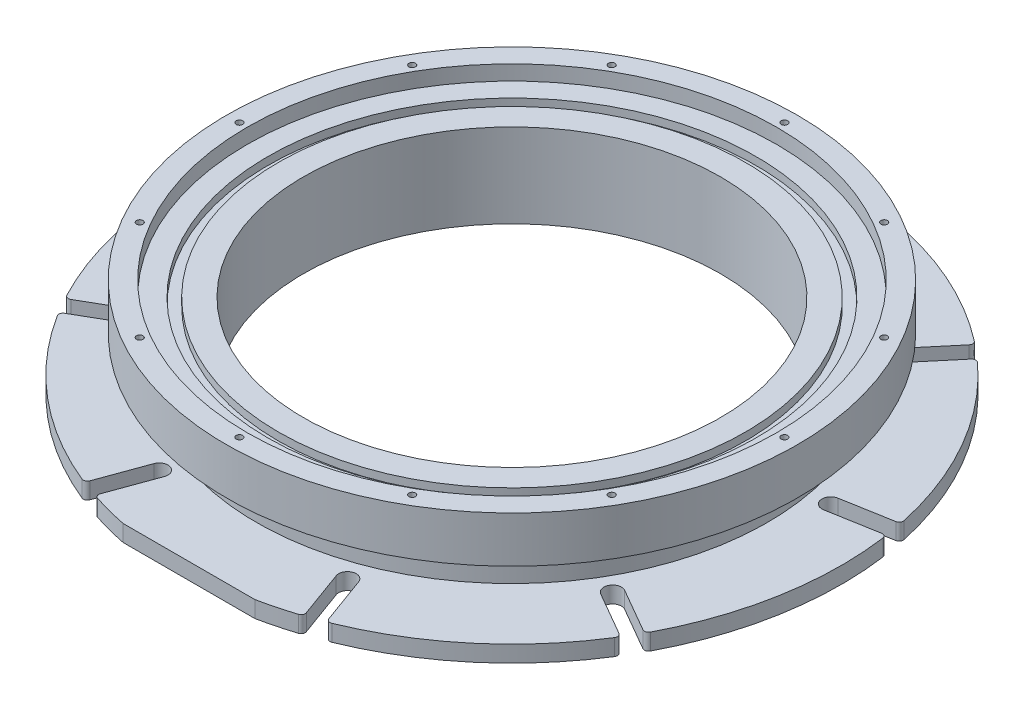
from build123d import *

# Parameters (mm, degrees)
M3X0_5_TAPPED_HOLE1_D     = 2.5
M3X0_5_TAPPED_HOLE1_DEPTH = 13.4874
M3X0_5_TAPPED_HOLE1_TIP   = 0.751075774
CUT_EXTRUDE1_REACH        = 185.602
SKETCH7_W                 = 50.8
SKETCH7_H                 = 2.565921067
CUT_EXTRUDE2_REACH        = 185.602
FILLET1_R                 = 1.5875
CIRPATTERN1_COUNT         = 9
FILLET1_OF_CIRPATTERN1_R  = 1.5875
SKETCH11_R                = 94
SKETCH11_R_2              = 90
CUT_EXTRUDE3_DEPTH        = 3


with BuildPart() as part:
    # Sketch1 → Revolve1 (revolve)
    with BuildSketch(Plane.XY, mode=Mode.PRIVATE) as revolve1_sk:
        Polygon((80.3783, 0), (127, 0), (127, 6.35), (98.425, 6.35), (98.425, 20.32), (110, 20.32), (110, 38.1), (102, 38.1), (102, 32.34), (80.3783, 32.34), align=None)
    revolve(revolve1_sk.sketch.rotate(Axis((0, 0, 0), (0, 1, 0)), 90), axis=Axis((0, 0, 0), (0, 1, 0)))

    # M3x0.5 Tapped Hole1
    with Locations(Plane(origin=(0, 38.1, 0), x_dir=(1, 0, 0), z_dir=(0, 1, 0))):
        with Locations((0, 105), (52.5, 90.932667397), (90.932667397, 52.5), (105, 0), (90.932667397, -52.5), (52.5, -90.932667397), (0, -105), (-52.5, -90.932667397), (-90.932667397, -52.5), (-105, 0), (-90.932667397, 52.5), (-52.5, 90.932667397)):
            Hole(M3X0_5_TAPPED_HOLE1_D / 2, depth=M3X0_5_TAPPED_HOLE1_DEPTH)
            with Locations((0, 0, -(M3X0_5_TAPPED_HOLE1_DEPTH + M3X0_5_TAPPED_HOLE1_TIP / 2))):  # 118° drill point
                Cone(0, M3X0_5_TAPPED_HOLE1_D / 2, M3X0_5_TAPPED_HOLE1_TIP, mode=Mode.SUBTRACT)

    # Sketch7 → Cut-Extrude1 (cut, up to next)
    with BuildSketch(Plane(origin=(0, 0, 0), x_dir=(1, 0, 0), z_dir=(0, 1, 0)), mode=Mode.PRIVATE) as cut_extrude1_sk1:
        with Locations((0, -125.717039467)):
            Rectangle(SKETCH7_W, SKETCH7_H)
    cut_extrude1_tool1 = extrude(cut_extrude1_sk1.sketch, amount=CUT_EXTRUDE1_REACH, mode=Mode.PRIVATE) & part.part
    add(cut_extrude1_tool1.solids().sort_by_distance((0, 0, 125.717039))[0], mode=Mode.SUBTRACT)

    # Sketch10 → Cut-Extrude2 (cut, up to next)
    with BuildSketch(Plane.XZ, mode=Mode.PRIVATE) as cut_extrude2_sk1:
        with BuildLine():
            Line((-3.3782, -106.045), (-3.3782, -127))
            Line((-3.3782, -127), (3.3782, -127))
            Line((3.3782, -127), (3.3782, -106.045))
            ThreePointArc((3.3782, -106.045), (0, -102.6668), (-3.3782, -106.045))
        make_face()
    cut_extrude2_tool1 = extrude(cut_extrude2_sk1.sketch, amount=-CUT_EXTRUDE2_REACH, mode=Mode.PRIVATE) & part.part
    cut_extrude2 = cut_extrude2_tool1.solids().sort_by_distance((0, 0, -115.183843))[0]
    add(cut_extrude2, mode=Mode.SUBTRACT)

    # Fillet1
    fillet1_edges = [part.edges().sort_by_distance(p)[0] for p in [
        (-3.3782, 3.175, -126.95506199),
        (3.3782, 3.175, -126.95506199),
    ]]
    fillet(fillet1_edges, radius=FILLET1_R)

    # CirPattern1: Cut-Extrude2 ×9 about axis
    cirpattern1_axis = Axis((0, 0, 0), (0, 1, 0))
    for i in range(1, CIRPATTERN1_COUNT):
        add(cut_extrude2.rotate(cirpattern1_axis, i * 360 / CIRPATTERN1_COUNT), mode=Mode.SUBTRACT)

    # Fillet1 of CirPattern1
    fillet1_of_cirpattern1_edges = [part.edges().sort_by_distance(p)[0] for p in [
        (-84.192992172, 3.175, -95.08175466),
        (-79.017289496, 3.175, -99.424684866),
        (-125.612947605, 3.175, -18.718637609),
        (-124.439711058, 3.175, -25.372392711),
        (-108.257208822, 3.175, 66.403138014),
        (-111.635408822, 3.175, 60.551923976),
        (-40.246718886, 3.175, 120.454147371),
        (-46.595658109, 3.175, 118.143322475),
        (46.595658109, 3.175, 118.143322475),
        (40.246718886, 3.175, 120.454147371),
        (111.635408822, 3.175, 60.551923976),
        (108.257208822, 3.175, 66.403138014),
        (124.439711058, 3.175, -25.372392711),
        (125.612947605, 3.175, -18.718637609),
        (79.017289496, 3.175, -99.424684866),
        (84.192992172, 3.175, -95.08175466),
    ]]
    fillet(fillet1_of_cirpattern1_edges, radius=FILLET1_OF_CIRPATTERN1_R)

    # Sketch11 → Cut-Extrude3 (cut)
    with BuildSketch(Plane(origin=(0, 32.34, 0), x_dir=(1, 0, 0), z_dir=(0, 1, 0))):
        with Locations(Location((0, 0, 0), (0, 0, 270))):
            Circle(SKETCH11_R)
        with Locations(Location((0, 0, 0), (0, 0, 270))):
            Circle(SKETCH11_R_2, mode=Mode.SUBTRACT)
    extrude(amount=-CUT_EXTRUDE3_DEPTH, mode=Mode.SUBTRACT)


solid = part.part
